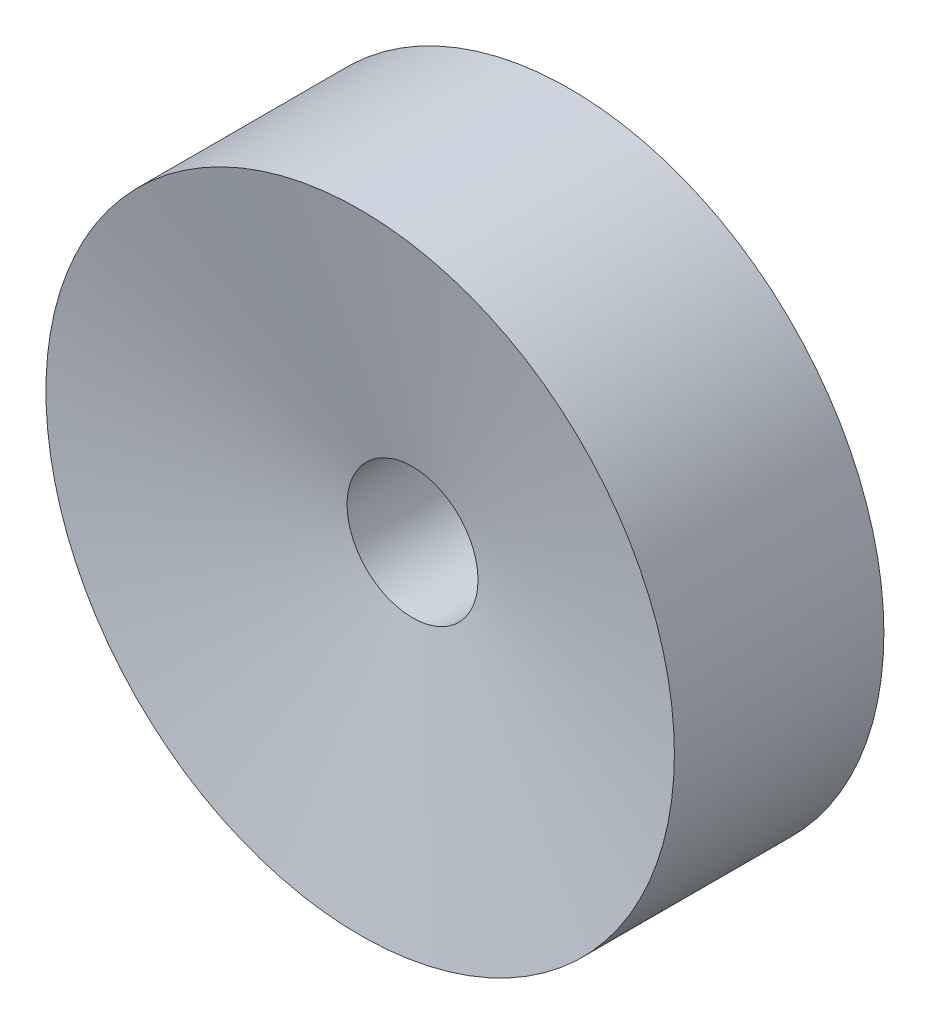
from build123d import *


with BuildPart() as part:
    # Sketch2 → Revolve1 (revolve)
    with BuildSketch(Plane(origin=(0, 0, 0), x_dir=(0, 0, -1), z_dir=(1, 0, 0)), mode=Mode.PRIVATE) as revolve1_sk:
        Polygon((12.7, 15.875), (-12.7, 15.875), (-25.4, 76.2), (25.4, 76.2), align=None)
    revolve(revolve1_sk.sketch.rotate(Axis((0, 0, 9.946513058), (0, 0, -1)), 90), axis=Axis((0, 0, 9.946513058), (0, 0, -1)))


solid = part.part
